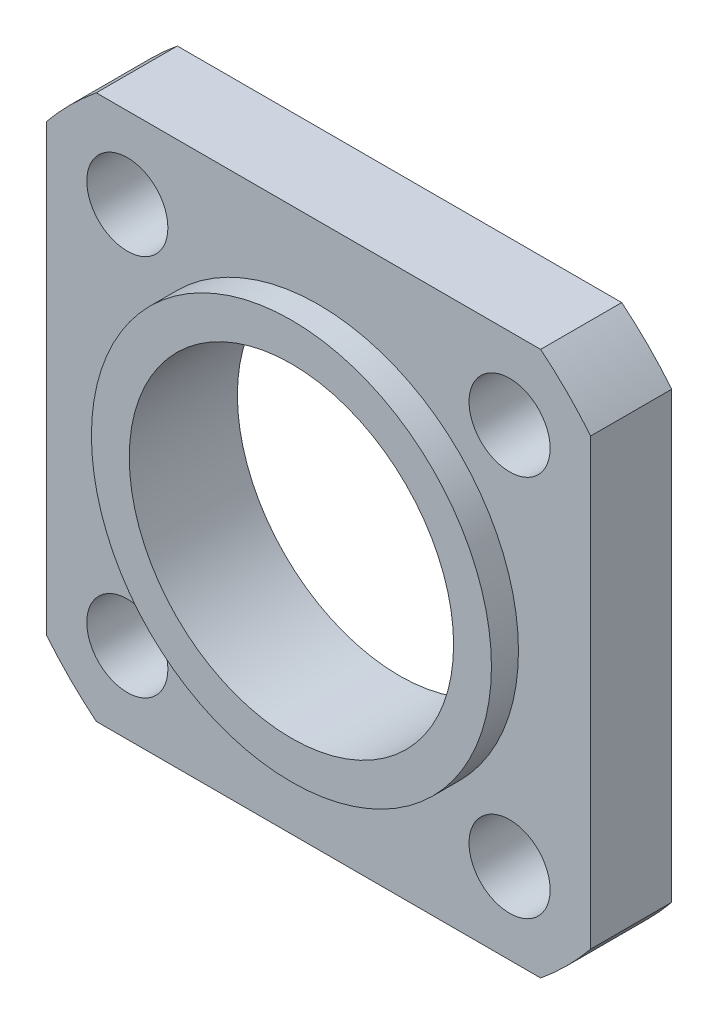
from build123d import *

# Parameters (mm, degrees)
SKETCH_1_R          = 13
SKETCH_1_R_2        = 6
SKETCH_1_R_3        = 1.5
EXTRUDE_1_DEPTH     = 3
SKETCH_2_R          = 7.4
SKETCH_2_R_2        = 6
EXTRUDE_2_DEPTH     = 1
CUT_EXTRUDE_START   = -41
CUT_EXTRUDE_1_DEPTH = 41


with BuildPart() as part:
    # 草图1 → 凸台-拉伸1 (new body)
    with BuildSketch(Plane.XY):
        Circle(SKETCH_1_R)
        Circle(SKETCH_1_R_2, mode=Mode.SUBTRACT)
        with Locations((-7.071067812, 7.071067812)):
            Circle(SKETCH_1_R_3, mode=Mode.SUBTRACT)
        with Locations((7.071067812, 7.071067812)):
            Circle(SKETCH_1_R_3, mode=Mode.SUBTRACT)
        with Locations((7.071067812, -7.071067812)):
            Circle(SKETCH_1_R_3, mode=Mode.SUBTRACT)
        with Locations((-7.071067812, -7.071067812)):
            Circle(SKETCH_1_R_3, mode=Mode.SUBTRACT)
    extrude(amount=EXTRUDE_1_DEPTH)

    # 草图2 → 凸台-拉伸2 (add)
    with BuildSketch(Plane.XY.offset(3)):
        Circle(SKETCH_2_R)
        Circle(SKETCH_2_R_2, mode=Mode.SUBTRACT)
    extrude(amount=EXTRUDE_2_DEPTH)

    # 草图3 → 切除-拉伸1 (cut)
    with BuildSketch(Plane.XY.offset(3).offset(CUT_EXTRUDE_START)):
        with BuildLine():
            Line((-8.220315878, 10.071067812), (8.220315878, 10.071067812))
            ThreePointArc((8.220315878, 10.071067812), (0, 13), (-8.220315878, 10.071067812))
        make_face()
        with BuildLine():
            Line((10.071067812, 8.220315878), (10.071067812, -8.220315878))
            ThreePointArc((10.071067812, -8.220315878), (13, 0), (10.071067812, 8.220315878))
        make_face()
        with BuildLine():
            Line((8.220315878, -10.071067812), (-8.220315878, -10.071067812))
            ThreePointArc((-8.220315878, -10.071067812), (0, -13), (8.220315878, -10.071067812))
        make_face()
        with BuildLine():
            Line((-10.071067812, -8.220315878), (-10.071067812, 8.220315878))
            ThreePointArc((-10.071067812, 8.220315878), (-13, 0), (-10.071067812, -8.220315878))
        make_face()
    extrude(amount=CUT_EXTRUDE_1_DEPTH, mode=Mode.SUBTRACT)


solid = part.part
